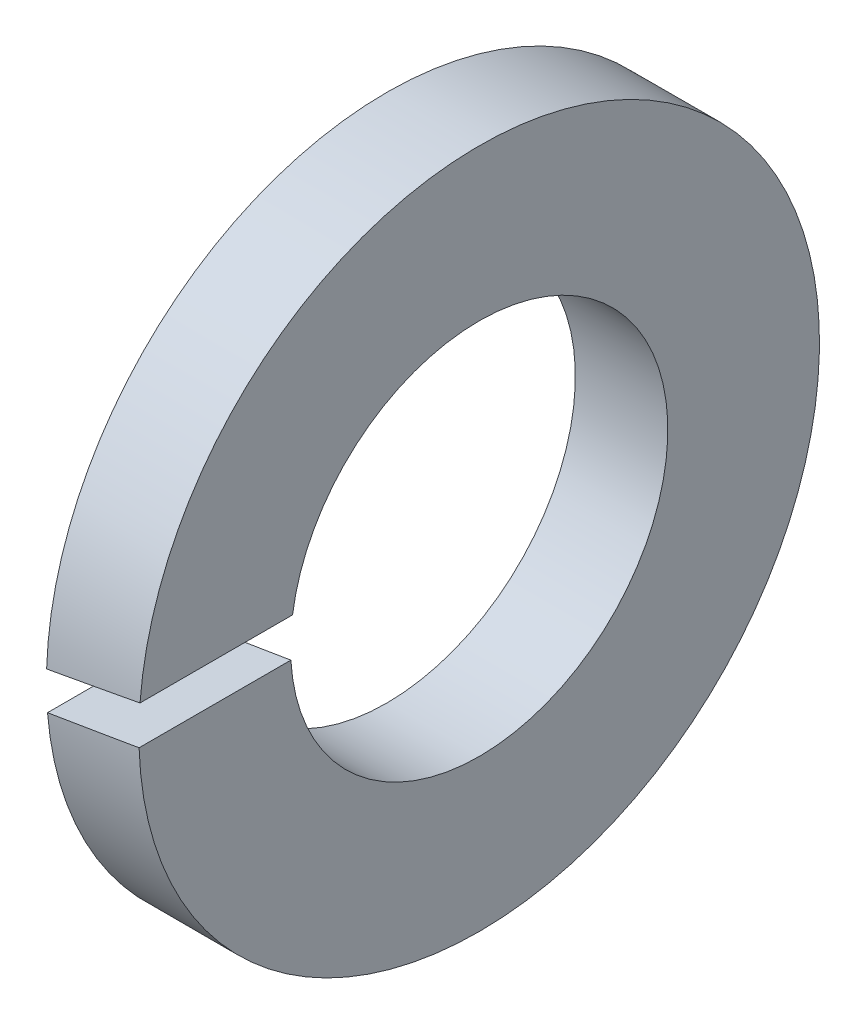
from build123d import *

# Parameters (mm, degrees)
SKETCH_1_W          = 2.5
SKETCH_1_H          = 4.1
CUT_EXTRUDE_1_DEPTH = 18.4


with BuildPart() as part:
    # 草图1 → 旋转1 (revolve)
    with BuildSketch(Plane.XY):
        with Locations((0, 7.15)):
            Rectangle(SKETCH_1_W, SKETCH_1_H)
    revolve(axis=Axis((1.25, 0, 0), (-1, 0, 0)))

    # 草图2 → 切除-拉伸1 (cut)
    with BuildSketch(Plane.XY):
        Polygon((-2.550579953, 0.06813151), (-2.373458812, -0.936372398), (2.550579953, -0.06813151), (2.373458812, 0.936372398), align=None)
    extrude(amount=CUT_EXTRUDE_1_DEPTH, mode=Mode.SUBTRACT)


solid = part.part
